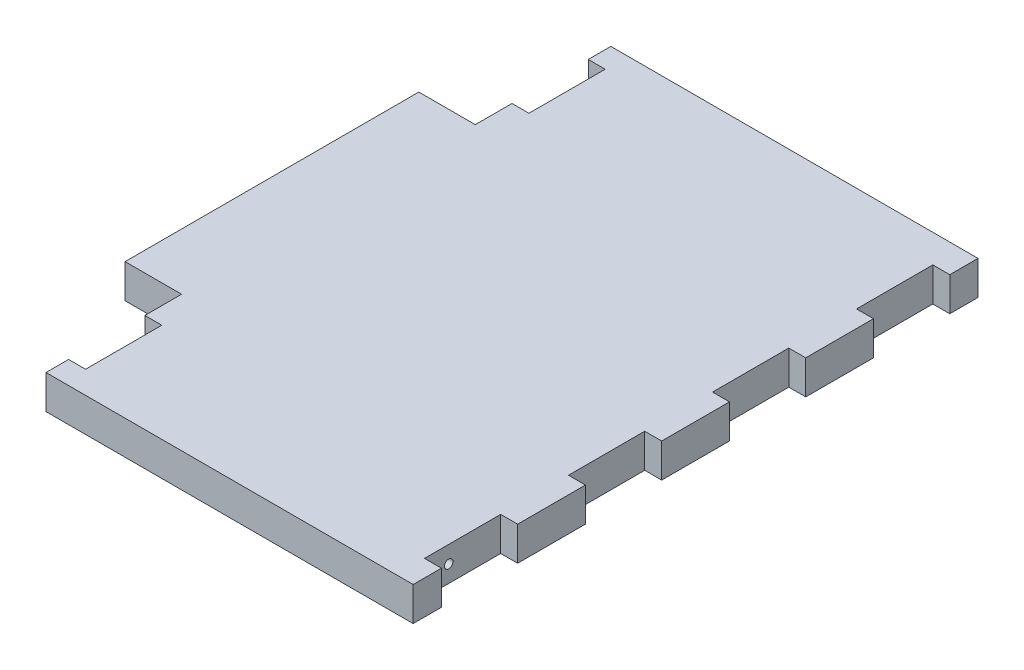
from build123d import *

# Parameters (mm, degrees)
SKETCH_1_W          = 75
SKETCH_1_H          = 100
EXTRUDE_1_DEPTH     = 6
SKETCH_3_R          = 0.75
CUT_EXTRUDE_1_DEPTH = 7
SKETCH_4_W          = 12.62553929
SKETCH_4_H          = 13.5
SKETCH_4_W_2        = 12.874809427
SKETCH_4_W_3        = 12.837463025
CUT_EXTRUDE_2_DEPTH = 75.027022093


with BuildPart() as part:
    # Эскиз1 → Вытянуть1 (new body)
    with BuildSketch(Plane(origin=(0, 0, 0), x_dir=(1, 0, 0), z_dir=(0, 1, 0))):
        with Locations((2.5, 12)):
            Rectangle(SKETCH_1_W, SKETCH_1_H)
    extrude(amount=EXTRUDE_1_DEPTH)

    # Эскиз3 → Вырез-Вытянуть1 (cut)
    with BuildSketch(Plane(origin=(40, 0, 0), x_dir=(0, 0, -1), z_dir=(1, 0, 0))):
        with Locations((-28.708129091, 3)):
            Circle(SKETCH_3_R)
    extrude(amount=-CUT_EXTRUDE_1_DEPTH, mode=Mode.SUBTRACT)

    # Эскиз4 → Вырез-Вытянуть2 (cut, through all)
    with BuildSketch(Plane.XZ):
        with Locations((43.312769645, 26.25)):
            Rectangle(SKETCH_4_W, SKETCH_4_H)
        with Locations((43.437404714, -50.25)):
            Rectangle(SKETCH_4_W_2, SKETCH_4_H)
        Polygon((-35, -38), (-35, -62), (-25, -62), (-25, -58), (-22, -58), (-22, -44.5), (-25, -44.5), (-25, -38), align=None)
        with Locations((43.418731513, 0.75)):
            Rectangle(SKETCH_4_W_3, SKETCH_4_H)
        with Locations((43.418731513, -24.75)):
            Rectangle(SKETCH_4_W_3, SKETCH_4_H)
        Polygon((-35, 14), (-25, 14), (-25, 20.5), (-22, 20.5), (-22, 34), (-25, 34), (-25, 38), (-35, 38), align=None)
    extrude(amount=-CUT_EXTRUDE_2_DEPTH, mode=Mode.SUBTRACT)


solid = part.part
